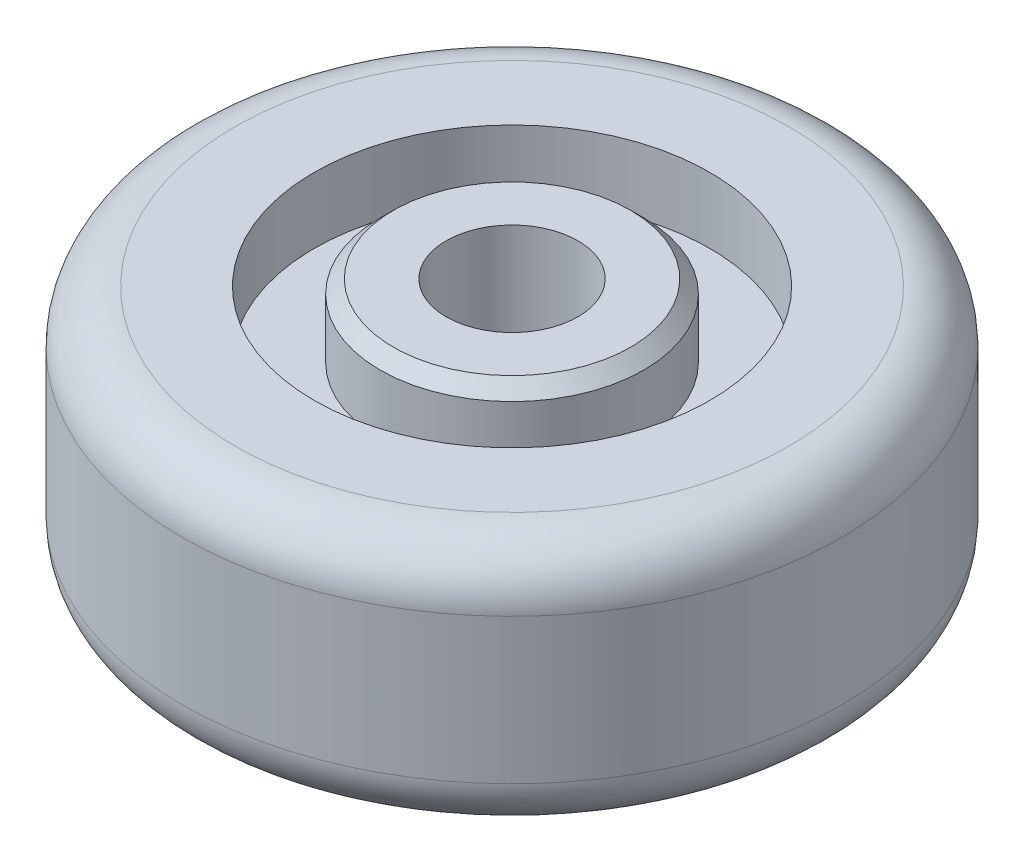
from build123d import *

# Parameters (mm, degrees)
FILLET1_R     = 4
CHAMFER1_SIZE = 1


with BuildPart() as part:
    # Sketch2 → Revolve1 (revolve)
    with BuildSketch(Plane(origin=(0, 0, 0), x_dir=(0, 0, -1), z_dir=(1, 0, 0)), mode=Mode.PRIVATE) as revolve1_sk:
        Polygon((10, 10), (10, 4.5), (15, 4.5), (15, 9.5), (25, 9.5), (25, -9.5), (15, -9.5), (15, -4.5), (10, -4.5), (10, -10), (5, -10), (5, 10), align=None)
    revolve(revolve1_sk.sketch.rotate(Axis((0, 38.551811756, 0), (0, -1, 0)), 180), axis=Axis((0, 38.551811756, 0), (0, -1, 0)))

    # Fillet1
    fillet1_edges = [part.edges().sort_by_distance(p)[0] for p in [
        (0, -9.5, -15),
        (0, -9.5, -25),
        (0, 9.5, -25),
    ]]
    fillet(fillet1_edges, radius=FILLET1_R)

    # Chamfer1
    chamfer1_edges = [part.edges().sort_by_distance(p)[0] for p in [
        (0, -10, -10),
        (0, 10, -10),
    ]]
    chamfer(chamfer1_edges, length=CHAMFER1_SIZE)


solid = part.part
